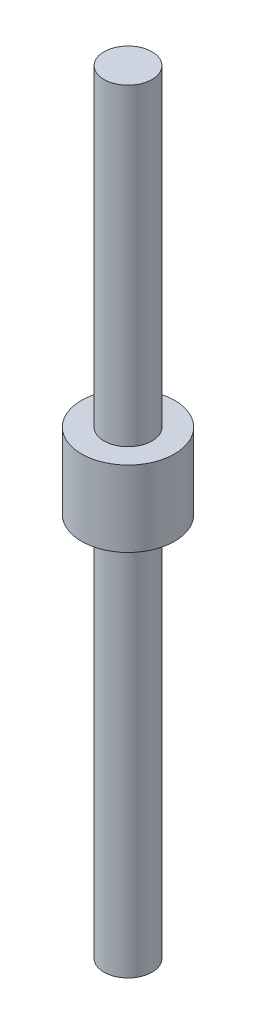
from build123d import *


with BuildPart() as part:
    # Sketch1 → Revolve1 (revolve)
    with BuildSketch(Plane.XY, mode=Mode.PRIVATE) as revolve1_sk:
        Polygon((0, 0), (0, 102.187397156), (3.175, 102.187397156), (3.175, 60.808518507), (6.14516129, 60.808518507), (6.14516129, 50.8), (3.175, 50.8), (3.175, 0), align=None)
    revolve(revolve1_sk.sketch.rotate(Axis((0, 0, 0), (0, 1, 0)), 90), axis=Axis((0, 0, 0), (0, 1, 0)))


solid = part.part
